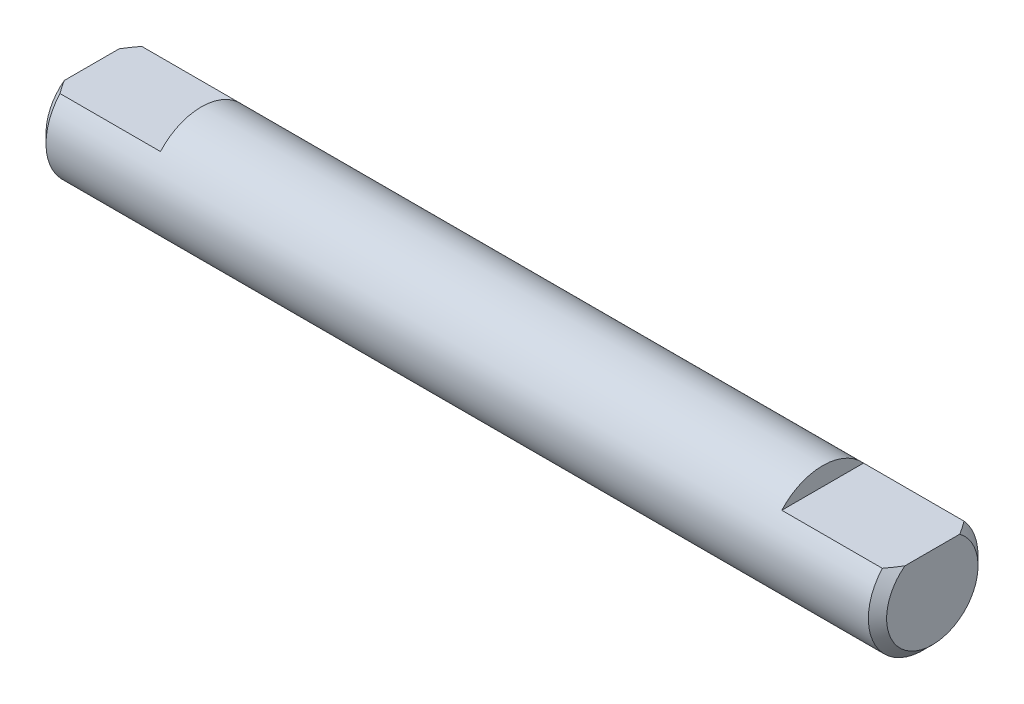
from build123d import *

# Parameters (mm, degrees)
SKETCH1_R           = 3
BOSS_EXTRUDE1_DEPTH = 23
CUT_EXTRUDE1_DEPTH  = 6
CHAMFER1_SIZE       = 0.5


with BuildPart() as part:
    # Sketch1 → Boss-Extrude1 (new, symmetric)
    with BuildSketch(Plane(origin=(0, 0, 0), x_dir=(0, 0, -1), z_dir=(1, 0, 0))):
        Circle(SKETCH1_R)
    extrude(amount=BOSS_EXTRUDE1_DEPTH, both=True)

    # Sketch2 → Cut-Extrude1 (cut)
    with BuildSketch(Plane(origin=(23, 0, 0), x_dir=(0, 0, -1), z_dir=(1, 0, 0))):
        with BuildLine():
            Line((-2.236067977, 2), (2.236067977, 2))
            ThreePointArc((2.236067977, 2), (0, 3), (-2.236067977, 2))
        make_face()
    cut_extrude1 = extrude(amount=-CUT_EXTRUDE1_DEPTH, mode=Mode.SUBTRACT)

    # Mirror1: Cut-Extrude1 across plane
    add(cut_extrude1.mirror(Plane(origin=(0, 0, 0), x_dir=(0, 0, 1), z_dir=(1, 0, 0))), mode=Mode.SUBTRACT)

    # Chamfer1
    chamfer1_edges = [part.edges().sort_by_distance(p)[0] for p in [
        (-23, -2.802517077, 1.070466269),
        (23, -2.802517077, 1.070466269),
    ]]
    chamfer(chamfer1_edges, length=CHAMFER1_SIZE)


solid = part.part
